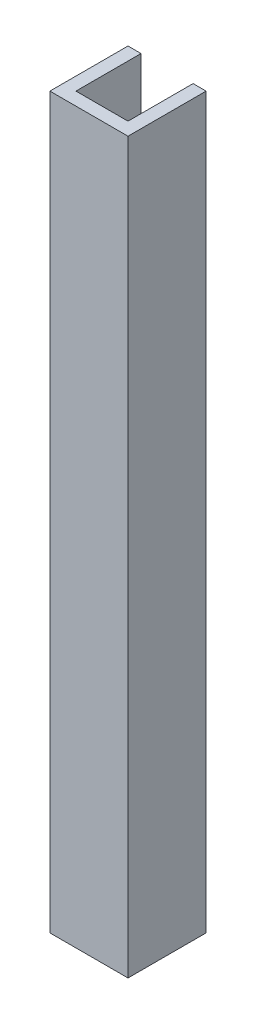
from build123d import *

# Parameters (mm, degrees)
BOSS_EXTRUDE1_DEPTH = 177.8


with BuildPart() as part:
    # Sketch1 → Boss-Extrude1 (new body)
    with BuildSketch(Plane(origin=(0, 0, 0), x_dir=(1, 0, 0), z_dir=(0, 1, 0))):
        Polygon((0, 0), (19.05, 0), (19.05, 19.05), (15.875, 19.05), (15.875, 3.175), (3.175, 3.175), (3.175, 19.05), (0, 19.05), align=None)
    extrude(amount=BOSS_EXTRUDE1_DEPTH)


solid = part.part
